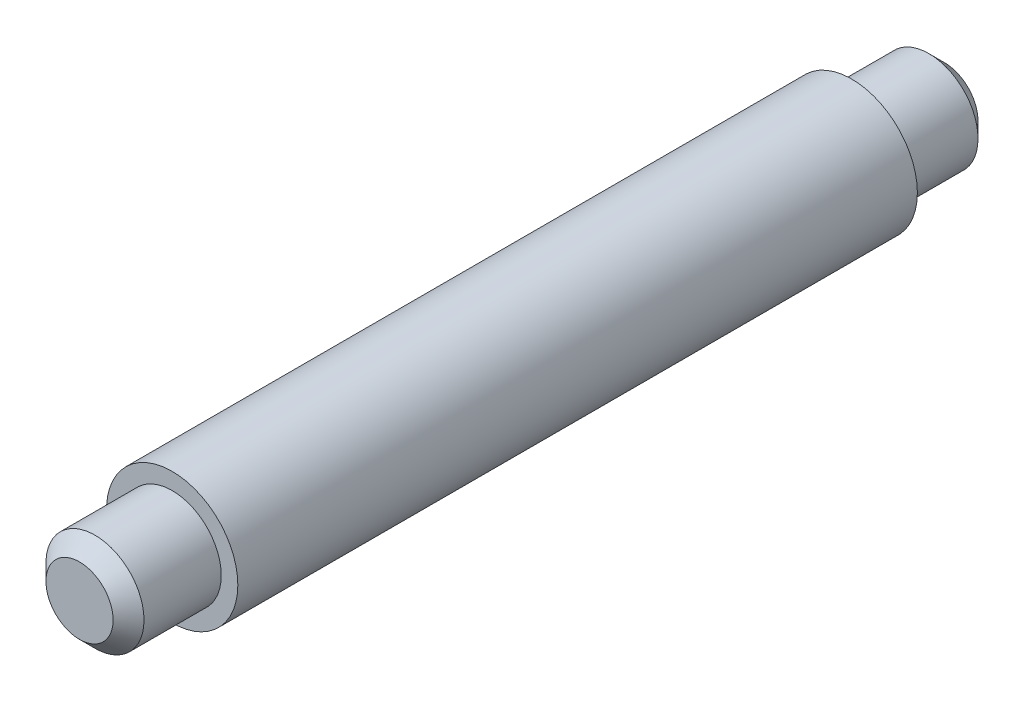
from build123d import *

# Parameters (mm, degrees)
SKETCH1_R           = 4.25
BOSS_EXTRUDE1_DEPTH = 22
SKETCH2_R           = 3.175
BOSS_EXTRUDE2_DEPTH = 6
CHAMFER1_SIZE       = 1
CHAMFER2_SIZE       = 1


with BuildPart() as part:
    # Sketch1 → Boss-Extrude1 (new, symmetric)
    with BuildSketch(Plane.XY):
        Circle(SKETCH1_R)
    extrude(amount=BOSS_EXTRUDE1_DEPTH, both=True)

    # Sketch2 → Boss-Extrude2 (add)
    with BuildSketch(Plane.XY.offset(22)):
        Circle(SKETCH2_R)
    boss_extrude2 = extrude(amount=BOSS_EXTRUDE2_DEPTH)

    # Chamfer1
    chamfer1_edges = [part.edges().sort_by_distance(p)[0] for p in [
        (-3.175, 0, 28),
    ]]
    chamfer(chamfer1_edges, length=CHAMFER1_SIZE)

    # Mirror1: Boss-Extrude2 across plane
    add(boss_extrude2.mirror(Plane.XY))

    # Chamfer2
    chamfer2_edges = [part.edges().sort_by_distance(p)[0] for p in [
        (-3.175, 0, -28),
    ]]
    chamfer(chamfer2_edges, length=CHAMFER2_SIZE)


solid = part.part
